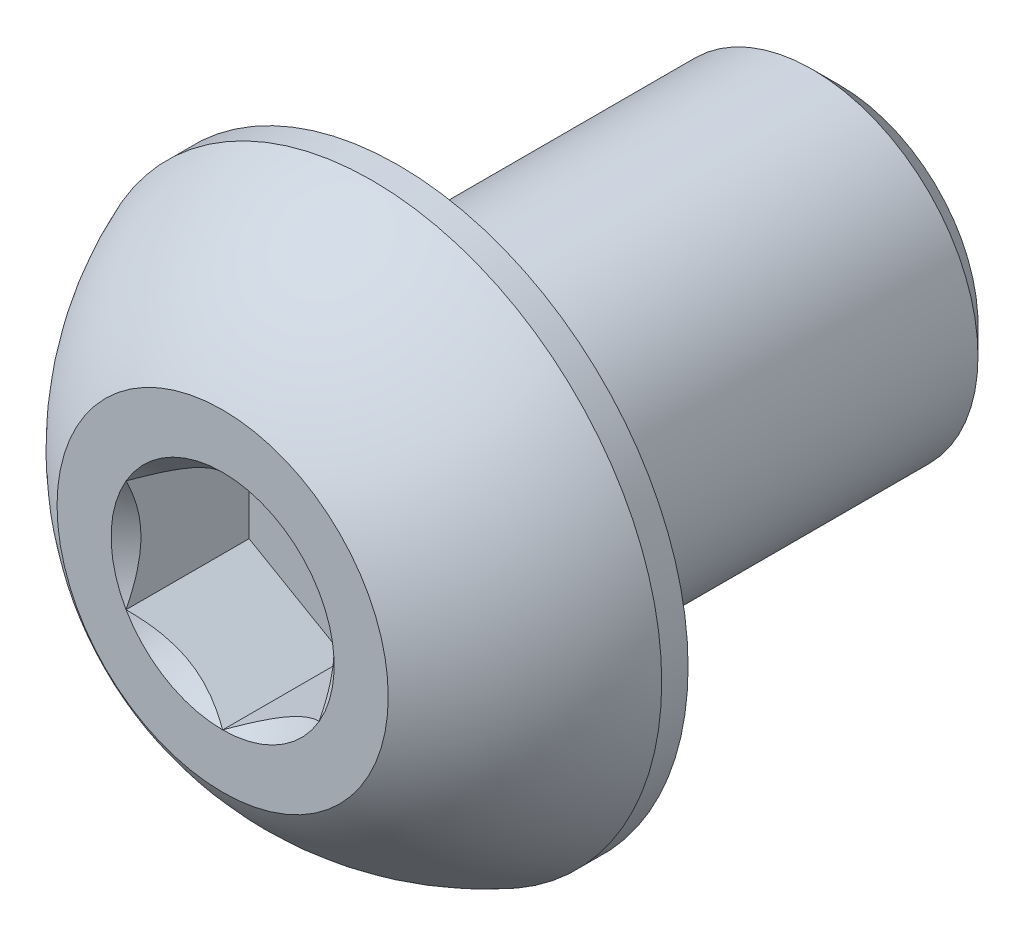
from build123d import *

# Parameters (mm, degrees)
SKETCH1_W          = 12.7
SKETCH1_H          = 4.7625
CHAMFER1_SIZE      = 0.79375
CUT_EXTRUDE2_DEPTH = 3.53822


with BuildPart() as part:
    # Sketch1 → Revolve1 (revolve)
    with BuildSketch(Plane(origin=(0, 0, 0), x_dir=(0, 0, -1), z_dir=(1, 0, 0))):
        with Locations((11.4046, 2.38125)):
            Rectangle(SKETCH1_W, SKETCH1_H)
    revolve(axis=Axis((0, 0, -17.7546), (0, 0, 1)))

    # Chamfer1
    chamfer1_edges = [part.edges().sort_by_distance(p)[0] for p in [
        (0, -4.7625, -17.7546),
    ]]
    chamfer(chamfer1_edges, length=CHAMFER1_SIZE)

    # Sketch7 → Revolve2 (revolve)
    with BuildSketch(Plane(origin=(0, 0, 0), x_dir=(0, 0, -1), z_dir=(1, 0, 0))):
        with BuildLine():
            Line((4.29641, 8.3312), (5.0546, 8.3312))
            Line((5.0546, 8.3312), (5.0546, 0))
            Line((5.0546, 0), (0, 0))
            Line((0, 0), (0, 4.7625))
            ThreePointArc((0, 4.7625), (1.862939611, 6.890285164), (4.29641, 8.3312))
        make_face()
    revolve(axis=Axis((0, 0, 0), (0, 0, -1)))

    # Sketch5 → Cut-Extrude2 (cut)
    with BuildSketch(Plane.XY):
        Polygon((2.778125, -1.603951217), (2.778125, 1.603951217), (0, 3.207902433), (-2.778125, 1.603951217), (-2.778125, -1.603951217), (0, -3.207902433), align=None)
    extrude(amount=-CUT_EXTRUDE2_DEPTH, mode=Mode.SUBTRACT)

    # Cut-Extrude3 cone 1 section (through the dimple's axis) → Cut-Extrude3 (revolve, cut)
    with BuildSketch(Plane(origin=(0, 0, 0), x_dir=(0, -1, 0), z_dir=(1, 0, 0))):
        Polygon((0, 0), (3.207902433, 0), (0, 3.207902433), align=None)
    revolve(axis=Axis((0, 0, 0), (0, 0, -1)), mode=Mode.SUBTRACT)


solid = part.part
